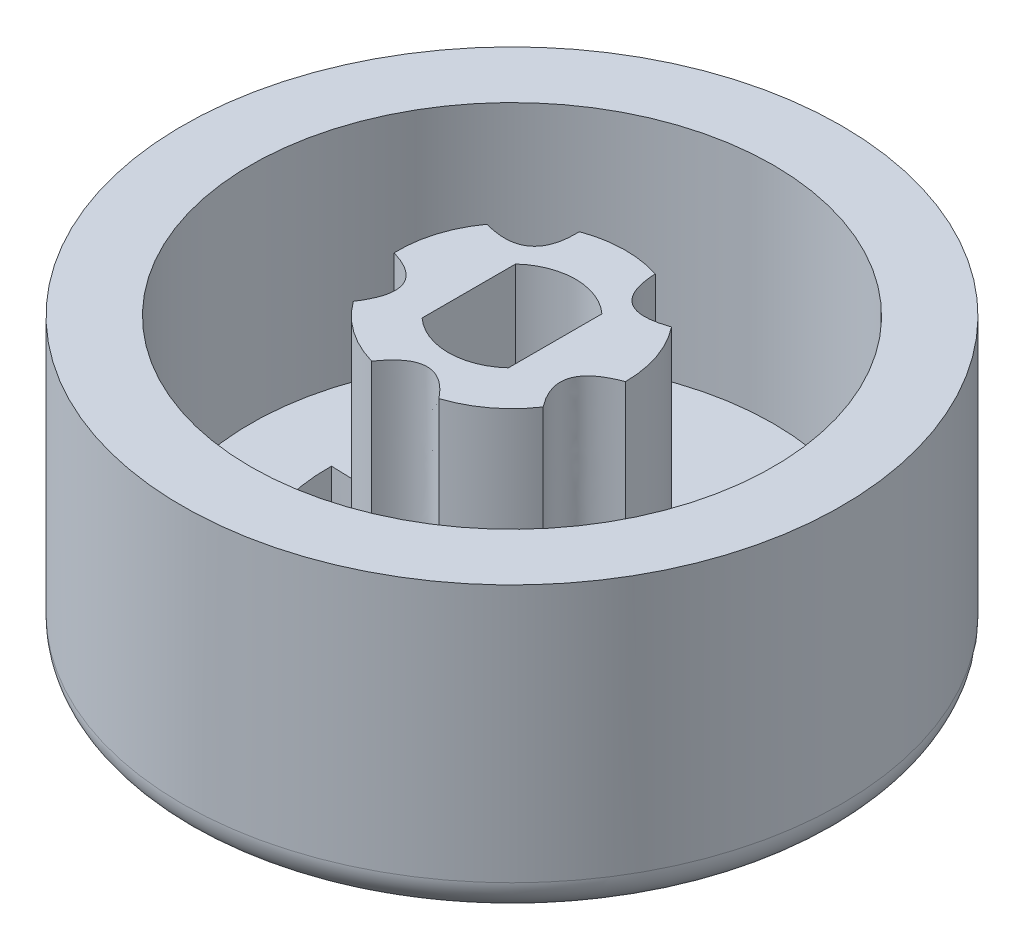
from build123d import *

# Parameters (mm, degrees)
CROQUIS1_R              = 14.5
SALIENTE_EXTRUIR1_DEPTH = 12.85
VACIADO1_T              = -3
REDONDEO1_R             = 1.5
CROQUIS2_R              = 8.1
SALIENTE_EXTRUIR2_DEPTH = 4
REDONDEO2_R             = 1.5
CROQUIS5_R              = 5
SALIENTE_EXTRUIR3_DEPTH = 9.85
CORTAR_EXTRUIR3_DEPTH   = 7
CORTAR_EXTRUIR2_START   = -37
CORTAR_EXTRUIR2_DEPTH   = 37
CROQUIS12_R             = 2.975585662
CORTAR_EXTRUIR4_DEPTH   = 5


with BuildPart() as part:
    # Croquis1 → Saliente-Extruir1 (new body)
    with BuildSketch(Plane(origin=(0, 0, 0), x_dir=(1, 0, 0), z_dir=(0, 1, 0))):
        with Locations(Location((0, 0, 0), (0, 0, 90))):
            Circle(CROQUIS1_R)
    extrude(amount=SALIENTE_EXTRUIR1_DEPTH)

    # Vaciado1
    vaciado1_openings = [part.faces().sort_by_distance(p)[0] for p in [
        (0, 12.85, 0),
    ]]
    offset(amount=VACIADO1_T, openings=vaciado1_openings, kind=Kind.INTERSECTION)

    # Redondeo1
    redondeo1_edges = [part.edges().sort_by_distance(p)[0] for p in [
        (0, 0, 14.5),
    ]]
    fillet(redondeo1_edges, radius=REDONDEO1_R)

    # Croquis2 → Saliente-Extruir2 (add)
    with BuildSketch(Plane.XZ):
        with Locations(Location((0, 0, 0), (0, 0, 90))):
            Circle(CROQUIS2_R)
    extrude(amount=SALIENTE_EXTRUIR2_DEPTH)

    # Redondeo2
    redondeo2_edges = [part.edges().sort_by_distance(p)[0] for p in [
        (0, -4, -8.1),
    ]]
    fillet(redondeo2_edges, radius=REDONDEO2_R)

    # Croquis5 → Saliente-Extruir3 (add)
    with BuildSketch(Plane(origin=(0, 3, 0), x_dir=(1, 0, 0), z_dir=(0, 1, 0))):
        with Locations(Location((0, 0, 0), (0, 0, 270))):
            Circle(CROQUIS5_R)
    extrude(amount=SALIENTE_EXTRUIR3_DEPTH)

    # Croquis6 → Cortar-Extruir3 (cut)
    with BuildSketch(Plane(origin=(0, 12.85, 0), x_dir=(1, 0, 0), z_dir=(0, 1, 0))):
        with BuildLine():
            ThreePointArc((1.9, 2.05669638), (0, 2.8), (-1.9, 2.05669638))
            Line((-1.9, 2.05669638), (-1.9, -2.05669638))
            ThreePointArc((-1.9, -2.05669638), (0, -2.8), (1.9, -2.05669638))
            Line((1.9, -2.05669638), (1.9, 2.05669638))
        make_face()
    extrude(amount=-CORTAR_EXTRUIR3_DEPTH, mode=Mode.SUBTRACT)

    # Croquis10 → Refrentado para tornillo con cabeza troncocónica de M2.51 (revolve, cut)
    with BuildSketch(Plane(origin=(0, -4, 0), x_dir=(0, 0, -1), z_dir=(1, 0, 0))):
        Polygon((0, 0), (0, 16.85), (1.45, 16.85), (1.45, 2.1), (3, 2.1), (3, 0), align=None)
    revolve(axis=Axis((0, -10.35, 0), (0, 1, 0)), mode=Mode.SUBTRACT)

    # Croquis4 → Cortar-Extruir2 (cut)
    with BuildSketch(Plane.XZ.offset(4).offset(CORTAR_EXTRUIR2_START)):
        with BuildLine():
            add(Edge.make_bspline(
                [(-6.599388447, -0.089845039), (-1.359491751, 0.374610057), (-5.09796541, 4.191747688)],
                knots=[0.102561593, 0.102561593, 0.102561593, 0.898650913, 0.898650913, 0.898650913], degree=2))
            ThreePointArc((-5.09796541, 4.191747688), (-6.228164327, 2.184025897), (-6.599388447, -0.089845039))
        make_face()
        with BuildLine():
            add(Edge.make_bspline(
                [(-5.09796541, 4.191747688), (-5.573905585, 4.677702471), (-6.195362716, 5.217995862)],
                knots=[0.898650913, 0.898650913, 0.898650913, 1, 1, 1], degree=2))
            ThreePointArc((-6.195362716, 5.217995862), (-7.634994566, 2.704969127), (-8.098538357, -0.153871615))
            add(Edge.make_bspline(
                [(-8.098538357, -0.153871615), (-7.274453594, -0.149681609), (-6.599388447, -0.089845039)],
                knots=[0, 0, 0, 0.102561593, 0.102561593, 0.102561593], degree=2))
            ThreePointArc((-6.599388447, -0.089845039), (-6.228164327, 2.184025897), (-5.09796541, 4.191747688))
        make_face()
        with BuildLine():
            ThreePointArc((-6.877081332, -4.279690684), (-4.931921587, -6.425429904), (-2.35624538, -7.749716621))
            add(Edge.make_bspline(
                [(-2.35624538, -7.749716621), (-2.105574116, -6.964670654), (-1.953875473, -6.30415503)],
                knots=[0, 0, 0, 0.102561593, 0.102561593, 0.102561593], degree=2))
            ThreePointArc((-1.953875473, -6.30415503), (-4.001740682, -5.248435149), (-5.561946902, -3.553131951))
            add(Edge.make_bspline(
                [(-5.561946902, -3.553131951), (-6.171190967, -3.85560967), (-6.877081332, -4.279690684)],
                knots=[0.898650913, 0.898650913, 0.898650913, 1, 1, 1], degree=2))
        make_face()
        with BuildLine():
            ThreePointArc((-5.561946902, -3.553131951), (-4.001740682, -5.248435149), (-1.953875473, -6.30415503))
            add(Edge.make_bspline(
                [(-1.953875473, -6.30415503), (-0.776381391, -1.177192615), (-5.561946902, -3.553131951)],
                knots=[0.102561593, 0.102561593, 0.102561593, 0.898650913, 0.898650913, 0.898650913], degree=2))
        make_face()
        with BuildLine():
            ThreePointArc((1.945092709, -7.862990166), (4.586899395, -6.6761032), (6.642298627, -4.63571666))
            add(Edge.make_bspline(
                [(6.642298627, -4.63571666), (5.973137225, -4.154721576), (5.391826995, -3.80633704)],
                knots=[0, 0, 0, 0.102561593, 0.102561593, 0.102561593], degree=2))
            ThreePointArc((5.391826995, -3.80633704), (3.754952571, -5.427737207), (1.660493181, -6.387704))
            add(Edge.make_bspline(
                [(1.660493181, -6.387704), (1.759899817, -7.060600294), (1.945092709, -7.862990166)],
                knots=[0.898650913, 0.898650913, 0.898650913, 1, 1, 1], degree=2))
        make_face()
        with BuildLine():
            ThreePointArc((1.660493181, -6.387704), (3.754952571, -5.427737207), (5.391826995, -3.80633704))
            add(Edge.make_bspline(
                [(5.391826995, -3.80633704), (0.879661663, -1.102155105), (1.660493181, -6.387704)],
                knots=[0.102561593, 0.102561593, 0.102561593, 0.898650913, 0.898650913, 0.898650913], degree=2))
        make_face()
        with BuildLine():
            ThreePointArc((6.6, 0), (6.262945457, 2.082189762), (5.286207817, 3.951709366))
            add(Edge.make_bspline(
                [(5.286207817, 3.951709366), (1.320042197, 0.496023299), (6.588188126, -0.394686231)],
                knots=[0.102561593, 0.102561593, 0.102561593, 0.898650913, 0.898650913, 0.898650913], degree=2))
            ThreePointArc((6.588188126, -0.394686231), (6.597046371, -0.19743147), (6.6, 0))
        make_face()
        with BuildLine():
            ThreePointArc((8.079214738, -0.579904492), (8.094802017, -0.290138435), (8.1, 0))
            ThreePointArc((8.1, 0), (7.679434703, 2.576098336), (6.461411694, 4.884686163))
            add(Edge.make_bspline(
                [(6.461411694, 4.884686163), (5.79717594, 4.396911507), (5.286207817, 3.951709366)],
                knots=[0, 0, 0, 0.102561593, 0.102561593, 0.102561593], degree=2))
            ThreePointArc((5.286207817, 3.951709366), (6.262945457, 2.082189762), (6.6, 0))
            ThreePointArc((6.6, 0), (6.597046371, -0.19743147), (6.588188126, -0.394686231))
            add(Edge.make_bspline(
                [(6.588188126, -0.394686231), (7.25886887, -0.508081293), (8.079214738, -0.579904492)],
                knots=[0.898650913, 0.898650913, 0.898650913, 1, 1, 1], degree=2))
        make_face()
        with BuildLine():
            add(Edge.make_bspline(
                [(-2.124770892, 6.248627742), (-0.063830719, 1.408714363), (2.411231005, 6.143774495)],
                knots=[0.102561593, 0.102561593, 0.102561593, 0.898650913, 0.898650913, 0.898650913], degree=2))
            ThreePointArc((2.411231005, 6.143774495), (0.152523441, 6.598237386), (-2.124770892, 6.248627742))
        make_face()
        with BuildLine():
            add(Edge.make_bspline(
                [(2.411231005, 6.143774495), (2.726327865, 6.746588786), (3.048136601, 7.50458948)],
                knots=[0.898650913, 0.898650913, 0.898650913, 1, 1, 1], degree=2))
            ThreePointArc((3.048136601, 7.50458948), (0.213235442, 8.097192763), (-2.648926585, 7.654618733))
            add(Edge.make_bspline(
                [(-2.648926585, 7.654618733), (-2.390285455, 6.872162332), (-2.124770892, 6.248627742)],
                knots=[0, 0, 0, 0.102561593, 0.102561593, 0.102561593], degree=2))
            ThreePointArc((-2.124770892, 6.248627742), (0.152523441, 6.598237386), (2.411231005, 6.143774495))
        make_face()
    extrude(amount=CORTAR_EXTRUIR2_DEPTH, mode=Mode.SUBTRACT)

    # Croquis12 → Cortar-Extruir4 (cut)
    with BuildSketch(Plane.XZ.offset(1.9)):
        with Locations(Location((0, 0, 0), (0, 0, 270))):
            Circle(CROQUIS12_R)
    extrude(amount=-CORTAR_EXTRUIR4_DEPTH, mode=Mode.SUBTRACT)


solid = part.part
